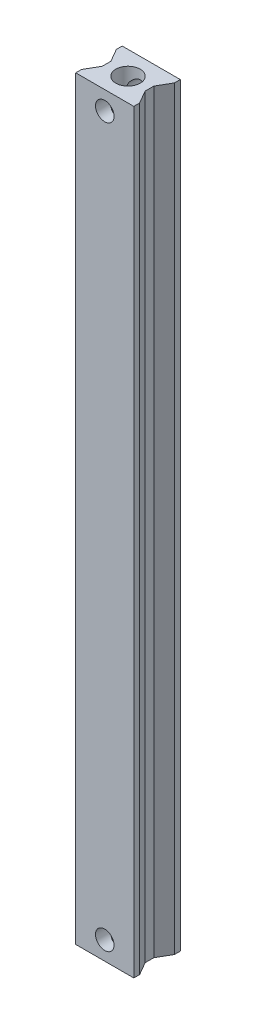
from build123d import *

# Parameters (mm, degrees)
SKETCH_1_R          = 2.1
EXTRUDE_1_DEPTH     = 130
SKETCH_2_R          = 1.6
CUT_EXTRUDE_1_DEPTH = 10


with BuildPart() as part:
    # 草图1 → 凸台-拉伸1 (new body)
    with BuildSketch(Plane(origin=(0, 0, 0), x_dir=(1, 0, 0), z_dir=(0, 1, 0))):
        Polygon((5, 3.235022849), (-5, 3.235022849), (-5, 2.235022849), (-3.7, -0.016643201), (-3.7, -1.516643201), (-5, -3.76830925), (-5, -4.76830925), (5, -4.76830925), (5, -3.76830925), (3.7, -1.516643201), (3.7, -0.016643201), (5, 2.235022849), align=None)
        with Locations(Location((0, -0.766643201, 0), (0, 0, 270))):
            Circle(SKETCH_1_R, mode=Mode.SUBTRACT)
    extrude(amount=EXTRUDE_1_DEPTH)

    # 草图2 → 切除-拉伸1 (cut)
    with BuildSketch(Plane(origin=(0, 0, -3.235022849), x_dir=(-1, 0, 0), z_dir=(0, 0, -1))):
        with Locations((0, 126.8)):
            Circle(SKETCH_2_R)
        with Locations((0, 3.2)):
            Circle(SKETCH_2_R)
    extrude(amount=-CUT_EXTRUDE_1_DEPTH, mode=Mode.SUBTRACT)


solid = part.part
